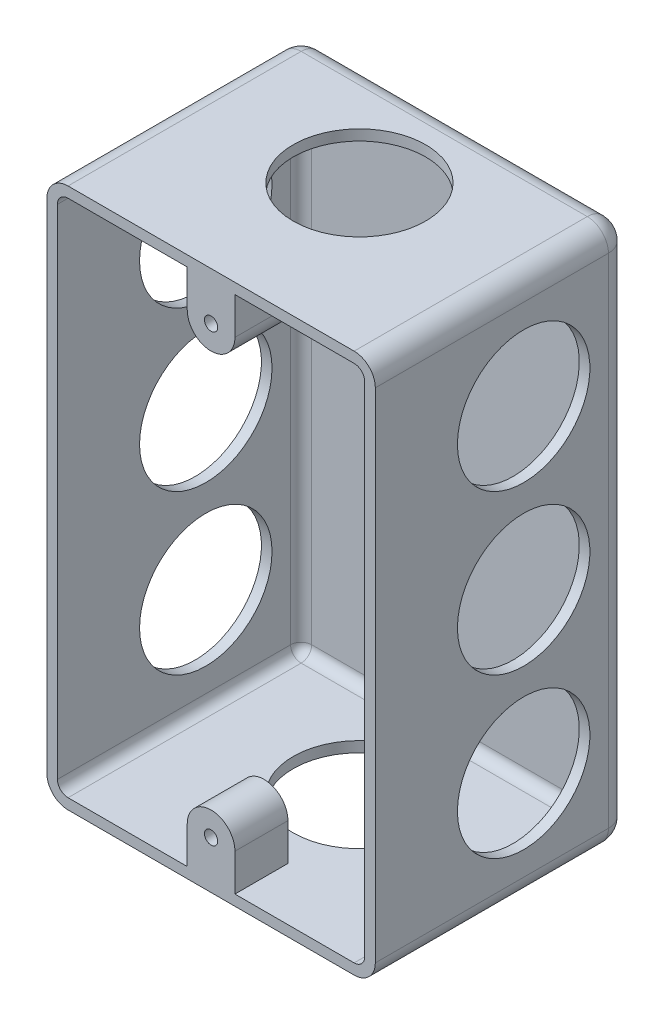
from build123d import *

# Parameters (mm, degrees)
ESBO_O1_W                = 62
ESBO_O1_H                = 102
RESSALTO_EXTRUS_O1_DEPTH = 48
FILETE1_R                = 4
CASCA1_T                 = -2
ESBO_O2_R                = 12.5
CORTE_EXTRUS_O1_DEPTH    = 94.536089292
ESBO_O3_R                = 12.5
CORTE_EXTRUS_O2_DEPTH    = 117.914498673
ESBO_O4_R                = 1.25
RESSALTO_EXTRUS_O2_DEPTH = 10


with BuildPart() as part:
    # Esboço1 → Ressalto-extrusão1 (new body)
    with BuildSketch(Plane.XY):
        Rectangle(ESBO_O1_W, ESBO_O1_H)
    extrude(amount=RESSALTO_EXTRUS_O1_DEPTH)

    # Filete1
    filete1_edges = [part.edges().sort_by_distance(p)[0] for p in [
        (0, -51, 0),
        (-31, 0, 0),
        (0, 51, 0),
        (31, 0, 0),
        (31, -51, 24),
        (-31, -51, 24),
        (-31, 51, 24),
        (31, 51, 24),
    ]]
    fillet(filete1_edges, radius=FILETE1_R)

    # Casca1
    casca1_openings = [part.faces().sort_by_distance(p)[0] for p in [
        (0, 0, 48),
    ]]
    offset(amount=CASCA1_T, openings=casca1_openings, kind=Kind.INTERSECTION)

    # Esboço2 → Corte-extrusão1 (cut, through all)
    with BuildSketch(Plane.ZY.offset(31)):
        with Locations((20, 0)):
            Circle(ESBO_O2_R)
        with Locations((20, 30)):
            Circle(ESBO_O2_R)
        with Locations((20, -30)):
            Circle(ESBO_O2_R)
    extrude(amount=-CORTE_EXTRUS_O1_DEPTH, mode=Mode.SUBTRACT)

    # Esboço3 → Corte-extrusão2 (cut, through all)
    with BuildSketch(Plane(origin=(0, 51, 0), x_dir=(1, 0, 0), z_dir=(0, 1, 0))):
        with Locations(Location((0, -20, 0), (0, 0, 270))):
            Circle(ESBO_O3_R)
    extrude(amount=-CORTE_EXTRUS_O2_DEPTH, mode=Mode.SUBTRACT)

    # Esboço4 → Ressalto-extrusão2 (add)
    # profile 1 of 2: a face of its own
    with BuildSketch(Plane.XY.offset(48)):
        with BuildLine():
            Line((-4.5, 42), (-4.5, 49))
            Line((-4.5, 49), (4.5, 49))
            Line((4.5, 49), (4.5, 42))
            ThreePointArc((4.5, 42), (0, 37.5), (-4.5, 42))
        make_face()
        with Locations((0, 42)):
            Circle(ESBO_O4_R, mode=Mode.SUBTRACT)
    # profile 2 of 2: a face of its own
    with BuildSketch(Plane.XY.offset(48)):
        with BuildLine():
            Line((4.5, -49), (-4.5, -49))
            Line((-4.5, -49), (-4.5, -42))
            ThreePointArc((-4.5, -42), (0, -37.5), (4.5, -42))
            Line((4.5, -42), (4.5, -49))
        make_face()
        with Locations(Location((0, -42, 0), (0, 0, 180))):
            Circle(ESBO_O4_R, mode=Mode.SUBTRACT)
    extrude(amount=-RESSALTO_EXTRUS_O2_DEPTH)


solid = part.part
